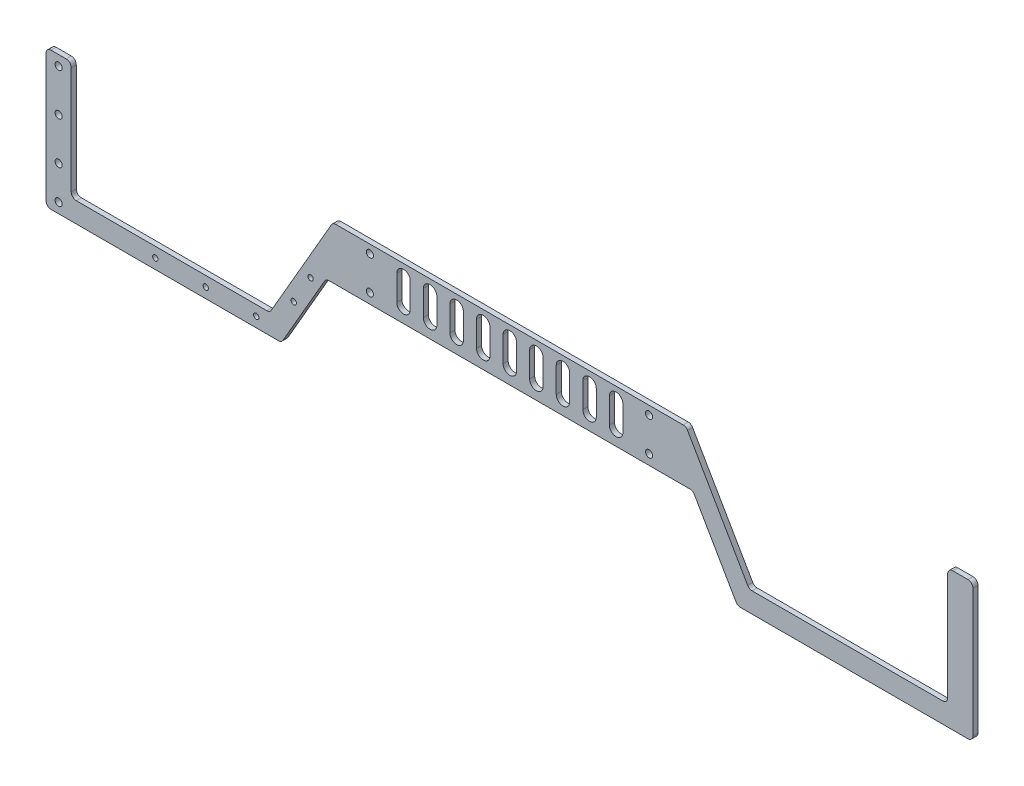
from build123d import *

# Parameters (mm, degrees)
SKETCH_1_R          = 1.6
SKETCH_1_R_2        = 2.1
EXTRUDE_2_DEPTH     = 3
SKETCH_2_R          = 2.1
CUT_EXTRUDE_1_DEPTH = 3
FILLET_1_R          = 3
CUT_EXTRUDE_2_DEPTH = 281.258651654


with BuildPart() as part:
    # 草图1 → 凸台-拉伸2 (new body)
    with BuildSketch(Plane.XY):
        Polygon((20.192307692, -5), (109.041451884, -5), (135.57179677, -50.951905284), (275.57179677, -50.951905284), (275.57179677, 31.048094716), (260.57179677, 31.048094716), (260.57179677, -38.951905284), (142.5, -38.951905284), (105, 26), (-105, 26), (-142.5, -38.951905284), (-260.57179677, -38.951905284), (-260.57179677, 31.048094716), (-275.57179677, 31.048094716), (-275.57179677, -50.951905284), (-135.57179677, -50.951905284), (-109.041451884, -5), (-20.192307692, -5), align=None)
        with Locations((-118.279056191, -9)):
            Circle(SKETCH_1_R, mode=Mode.SUBTRACT)
        with Locations((-128.279056191, -26.320508076)):
            Circle(SKETCH_1_R, mode=Mode.SUBTRACT)
        with Locations((-150.57179677, -44.951905284)):
            Circle(SKETCH_1_R, mode=Mode.SUBTRACT)
        with Locations((-180.57179677, -44.951905284)):
            Circle(SKETCH_1_R, mode=Mode.SUBTRACT)
        with Locations((-210.57179677, -44.951905284)):
            Circle(SKETCH_1_R, mode=Mode.SUBTRACT)
        with Locations((-268.07179677, -44.951905284)):
            Circle(SKETCH_1_R_2, mode=Mode.SUBTRACT)
        with Locations((-268.07179677, -24.951905284)):
            Circle(SKETCH_1_R_2, mode=Mode.SUBTRACT)
        with Locations((-268.07179677, 0.048094716)):
            Circle(SKETCH_1_R_2, mode=Mode.SUBTRACT)
        with Locations((-268.07179677, 25.048094716)):
            Circle(SKETCH_1_R_2, mode=Mode.SUBTRACT)
    extrude(amount=EXTRUDE_2_DEPTH)

    # 草图2 → 切除-拉伸1 (cut)
    with BuildSketch(Plane.XY.offset(3)):
        with Locations((-83, 21)):
            Circle(SKETCH_2_R)
        with Locations((-83, 1)):
            Circle(SKETCH_2_R)
        with Locations(Location((83, 1, 0), (0, 0, 180))):
            Circle(SKETCH_2_R)
        with Locations(Location((83, 21, 0), (0, 0, 180))):
            Circle(SKETCH_2_R)
    extrude(amount=-CUT_EXTRUDE_1_DEPTH, mode=Mode.SUBTRACT)

    # 圆角1
    fillet_1_edges = [part.edges().sort_by_distance(p)[0] for p in [
        (109.041451884, -5, 1.5),
        (-109.041451884, -5, 1.5),
        (135.57179677, -50.951905284, 1.5),
        (-135.57179677, -50.951905284, 1.5),
        (275.57179677, -50.951905284, 1.5),
        (275.57179677, 31.048094716, 1.5),
        (-275.57179677, -50.951905284, 1.5),
        (260.57179677, 31.048094716, 1.5),
        (-275.57179677, 31.048094716, 1.5),
        (260.57179677, -38.951905284, 1.5),
        (-260.57179677, 31.048094716, 1.5),
        (142.5, -38.951905284, 1.5),
        (-260.57179677, -38.951905284, 1.5),
        (105, 26, 1.5),
        (-142.5, -38.951905284, 1.5),
        (-105, 26, 1.5),
    ]]
    fillet(fillet_1_edges, radius=FILLET_1_R)

    # 草图3 → 切除-拉伸2 (cut, through all)
    with BuildSketch(Plane.XY.offset(3)):
        with BuildLine():
            Line((-59, 19), (-59, 4))
            ThreePointArc((-59, 4), (-63, 0), (-67, 4))
            Line((-67, 4), (-67, 19))
            ThreePointArc((-67, 19), (-63, 23), (-59, 19))
        make_face()
        with BuildLine():
            Line((-51.2, 19), (-51.2, 4))
            ThreePointArc((-51.2, 4), (-47.2, 0), (-43.2, 4))
            Line((-43.2, 4), (-43.2, 19))
            ThreePointArc((-43.2, 19), (-47.2, 23), (-51.2, 19))
        make_face()
        with BuildLine():
            Line((-35.4, 19), (-35.4, 4))
            ThreePointArc((-35.4, 4), (-31.4, 0), (-27.4, 4))
            Line((-27.4, 4), (-27.4, 19))
            ThreePointArc((-27.4, 19), (-31.4, 23), (-35.4, 19))
        make_face()
        with BuildLine():
            Line((-19.6, 19), (-19.6, 4))
            ThreePointArc((-19.6, 4), (-15.6, 0), (-11.6, 4))
            Line((-11.6, 4), (-11.6, 19))
            ThreePointArc((-11.6, 19), (-15.6, 23), (-19.6, 19))
        make_face()
        with BuildLine():
            Line((-3.8, 19), (-3.8, 4))
            ThreePointArc((-3.8, 4), (0.2, 0), (4.2, 4))
            Line((4.2, 4), (4.2, 19))
            ThreePointArc((4.2, 19), (0.2, 23), (-3.8, 19))
        make_face()
        with BuildLine():
            Line((12, 19), (12, 4))
            ThreePointArc((12, 4), (16, 0), (20, 4))
            Line((20, 4), (20, 19))
            ThreePointArc((20, 19), (16, 23), (12, 19))
        make_face()
        with BuildLine():
            Line((27.8, 19), (27.8, 4))
            ThreePointArc((27.8, 4), (31.8, 0), (35.8, 4))
            Line((35.8, 4), (35.8, 19))
            ThreePointArc((35.8, 19), (31.8, 23), (27.8, 19))
        make_face()
        with BuildLine():
            Line((43.6, 19), (43.6, 4))
            ThreePointArc((43.6, 4), (47.6, 0), (51.6, 4))
            Line((51.6, 4), (51.6, 19))
            ThreePointArc((51.6, 19), (47.6, 23), (43.6, 19))
        make_face()
        with BuildLine():
            Line((59.4, 19), (59.4, 4))
            ThreePointArc((59.4, 4), (63.4, 0), (67.4, 4))
            Line((67.4, 4), (67.4, 19))
            ThreePointArc((67.4, 19), (63.4, 23), (59.4, 19))
        make_face()
    extrude(amount=-CUT_EXTRUDE_2_DEPTH, mode=Mode.SUBTRACT)


solid = part.part
